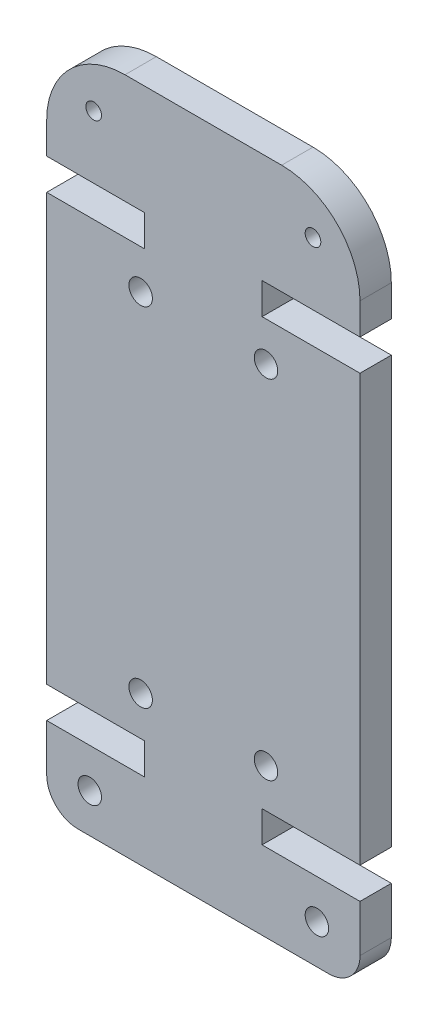
from build123d import *

# Parameters (mm, degrees)
MODEL_R             = 0.5
MODEL_R_2           = 0.75
BOSS_EXTRUDE1_DEPTH = 2


with BuildPart() as part:
    # Model → Boss-Extrude1 (new body)
    with BuildSketch(Plane.XY):
        with BuildLine():
            Line((1967.109841287, 1238.384705077), (1983.109841287, 1238.384705077))
            ThreePointArc((1983.109841287, 1238.384705077), (1984.524054849, 1238.970491514), (1985.109841287, 1240.384705077))
            Line((1985.109841287, 1240.384705077), (1985.109841287, 1243.384705077))
            Line((1985.109841287, 1243.384705077), (1978.859841287, 1243.384705077))
            Line((1978.859841287, 1243.384705077), (1978.859841287, 1245.384705077))
            Line((1978.859841287, 1245.384705077), (1985.109841287, 1245.384705077))
            Line((1985.109841287, 1245.384705077), (1985.109841287, 1272.584705077))
            Line((1985.109841287, 1272.584705077), (1978.859841287, 1272.584705077))
            Line((1978.859841287, 1272.584705077), (1978.859841287, 1274.584705077))
            Line((1978.859841287, 1274.584705077), (1985.109841287, 1274.584705077))
            Line((1985.109841287, 1274.584705077), (1985.109841287, 1276.584705077))
            ThreePointArc((1985.109841287, 1276.584705077), (1983.645375192, 1280.120238983), (1980.109841287, 1281.584705077))
            Line((1980.109841287, 1281.584705077), (1970.109841287, 1281.584705077))
            ThreePointArc((1970.109841287, 1281.584705077), (1966.574307381, 1280.120238983), (1965.109841287, 1276.584705077))
            Line((1965.109841287, 1276.584705077), (1965.109841287, 1274.584705077))
            Line((1965.109841287, 1274.584705077), (1971.359841287, 1274.584705077))
            Line((1971.359841287, 1274.584705077), (1971.359841287, 1272.584705077))
            Line((1971.359841287, 1272.584705077), (1965.109841287, 1272.584705077))
            Line((1965.109841287, 1272.584705077), (1965.109841287, 1245.384705077))
            Line((1965.109841287, 1245.384705077), (1971.359841287, 1245.384705077))
            Line((1971.359841287, 1245.384705077), (1971.359841287, 1243.384705077))
            Line((1971.359841287, 1243.384705077), (1965.109841287, 1243.384705077))
            Line((1965.109841287, 1243.384705077), (1965.109841287, 1240.384705077))
            ThreePointArc((1965.109841287, 1240.384705077), (1965.695627724, 1238.970491514), (1967.109841287, 1238.384705077))
        make_face()
        with Locations((1968.109841287, 1278.584705077)):
            Circle(MODEL_R, mode=Mode.SUBTRACT)
        with Locations((1982.109841287, 1278.584705077)):
            Circle(MODEL_R, mode=Mode.SUBTRACT)
        with Locations((1979.109841287, 1247.884705077)):
            Circle(MODEL_R_2, mode=Mode.SUBTRACT)
        with Locations((1971.109841287, 1247.884705077)):
            Circle(MODEL_R_2, mode=Mode.SUBTRACT)
        with Locations((1979.109841287, 1270.084705077)):
            Circle(MODEL_R_2, mode=Mode.SUBTRACT)
        with Locations((1971.109841287, 1270.084705077)):
            Circle(MODEL_R_2, mode=Mode.SUBTRACT)
        with Locations((1982.359841287, 1240.884705077)):
            Circle(MODEL_R_2, mode=Mode.SUBTRACT)
        with Locations((1967.859841287, 1240.884705077)):
            Circle(MODEL_R_2, mode=Mode.SUBTRACT)
    extrude(amount=BOSS_EXTRUDE1_DEPTH)


solid = part.part
